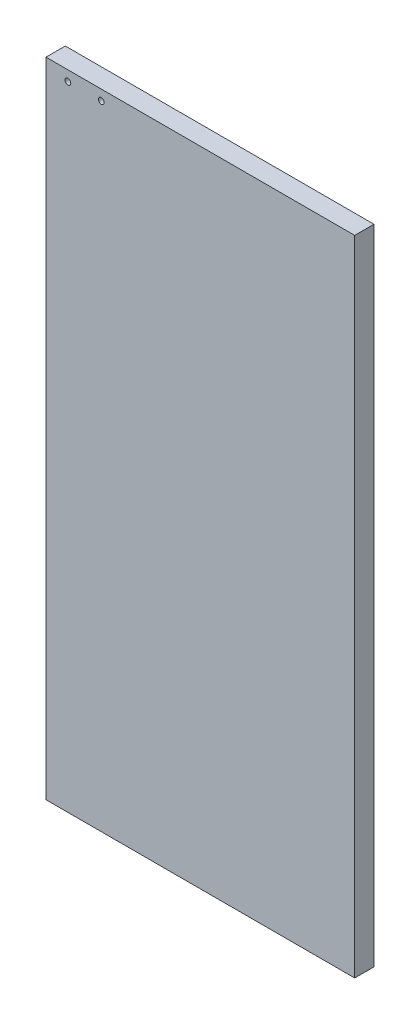
from build123d import *

# Parameters (mm, degrees)
ESQUISSE1_W                  = 240
ESQUISSE1_H                  = 500
BOSS_EXTRU_1_DEPTH           = 15
ENL_V_MAT_EXTRU_1_DEPTH      = 555.819790563
ENL_V_MAT_EXTRU_1_DEPTH_BACK = 555.819790563
ESQUISSE2_R                  = 2.25


with BuildPart() as part:
    # Esquisse1 → Boss.-Extru.1 (new body)
    with BuildSketch(Plane.XY):
        with Locations((120, 250)):
            Rectangle(ESQUISSE1_W, ESQUISSE1_H)
    extrude(amount=BOSS_EXTRU_1_DEPTH)

    # Esquisse2 → Enlèv. mat.-Extru.1 (cut, two sides: drawn at the far end of the back side and taken through both)
    with BuildSketch(Plane.XY.offset(15).offset(-ENL_V_MAT_EXTRU_1_DEPTH_BACK)):
        with Locations((17, 492)):
            Circle(ESQUISSE2_R)
        with Locations(Location((43, 492, 0), (0, 0, 180))):
            Circle(ESQUISSE2_R)
    extrude(amount=ENL_V_MAT_EXTRU_1_DEPTH + ENL_V_MAT_EXTRU_1_DEPTH_BACK, mode=Mode.SUBTRACT)


solid = part.part
